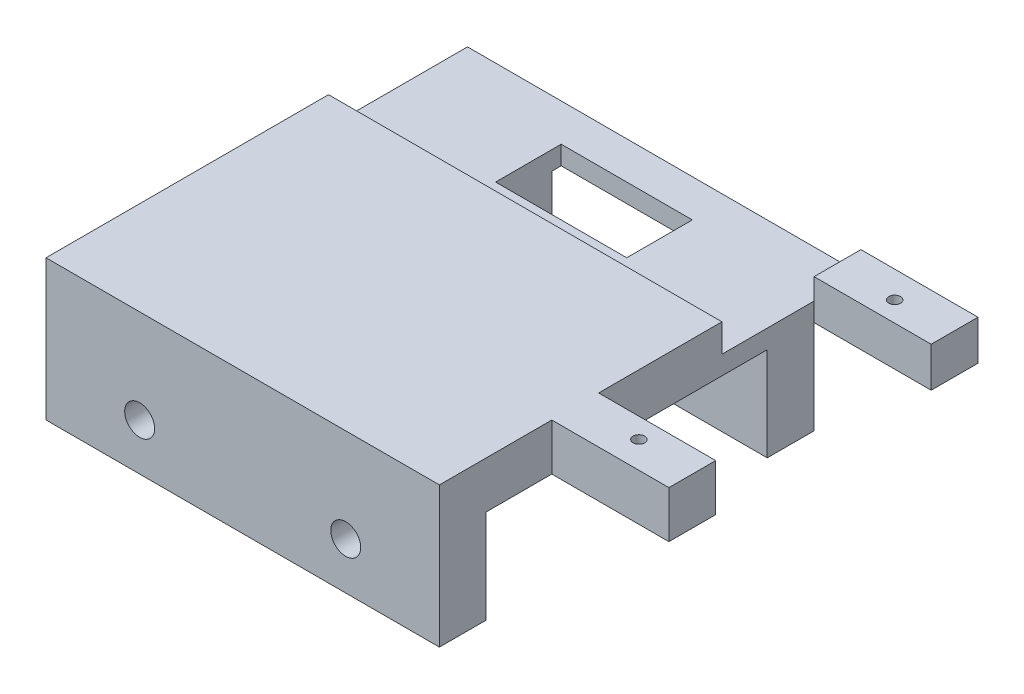
from build123d import *

# Parameters (mm, degrees)
SKETCH_1_W          = 42
SKETCH_1_H          = 45
EXTRUDE_1_DEPTH     = 5
SKETCH_2_W          = 42
SKETCH_2_H          = 5
EXTRUDE_2_DEPTH     = 10
SKETCH_3_R          = 1.6
CUT_EXTRUDE_1_DEPTH = 59.855755878
SKETCH_4_W          = 14
SKETCH_4_H          = 7
CUT_EXTRUDE_2_DEPTH = 64.356136246
SKETCH_5_W          = 42
SKETCH_5_H          = 14.838100381
CUT_EXTRUDE_3_DEPTH = 3
SKETCH_6_W          = 5
SKETCH_6_H          = 30
EXTRUDE_3_DEPTH     = 10
SKETCH_7_R          = 1.75
CUT_EXTRUDE_4_DEPTH = 60.110066825
SKETCH_8_R          = 3.5
CUT_EXTRUDE_5_DEPTH = 2
SKETCH_9_W          = 5
SKETCH_9_H          = 5
SKETCH_9_H_2        = 4.255093553
EXTRUDE_4_DEPTH     = 12.5
SKETCH_10_R         = 0.625
CUT_EXTRUDE_6_DEPTH = 72.381019886


with BuildPart() as part:
    # 草图1 → 凸台-拉伸1 (new body)
    with BuildSketch(Plane(origin=(0, 0, 0), x_dir=(1, 0, 0), z_dir=(0, 1, 0))):
        with Locations((21, -22.5)):
            Rectangle(SKETCH_1_W, SKETCH_1_H)
    extrude(amount=EXTRUDE_1_DEPTH)

    # 草图2 → 凸台-拉伸2 (add)
    with BuildSketch(Plane.XZ):
        with Locations((21, 42.5)):
            Rectangle(SKETCH_2_W, SKETCH_2_H)
        with Locations((21, 7.5)):
            Rectangle(SKETCH_2_W, SKETCH_2_H)
    extrude(amount=EXTRUDE_2_DEPTH)

    # 草图3 → 切除-拉伸1 (cut, through all)
    with BuildSketch(Plane(origin=(0, 0, 5), x_dir=(-1, 0, 0), z_dir=(0, 0, -1))):
        with Locations((-32, -5)):
            Circle(SKETCH_3_R)
        with Locations((-10, -5)):
            Circle(SKETCH_3_R)
    extrude(amount=-CUT_EXTRUDE_1_DEPTH, mode=Mode.SUBTRACT)

    # 草图4 → 切除-拉伸2 (cut, through all)
    with BuildSketch(Plane.XZ.offset(10)):
        with Locations((21, 7.5)):
            Rectangle(SKETCH_4_W, SKETCH_4_H)
    extrude(amount=-CUT_EXTRUDE_2_DEPTH, mode=Mode.SUBTRACT)

    # 草图5 → 切除-拉伸3 (cut)
    with BuildSketch(Plane(origin=(0, 5, 0), x_dir=(1, 0, 0), z_dir=(0, 1, 0))):
        with Locations((21, -7.419050191)):
            Rectangle(SKETCH_5_W, SKETCH_5_H)
    extrude(amount=-CUT_EXTRUDE_3_DEPTH, mode=Mode.SUBTRACT)

    # 草图6 → 凸台-拉伸3 (add)
    with BuildSketch(Plane.XZ):
        with Locations((2.5, 25)):
            Rectangle(SKETCH_6_W, SKETCH_6_H)
    extrude(amount=EXTRUDE_3_DEPTH)

    # 草图7 → 切除-拉伸4 (cut, through all)
    with BuildSketch(Plane(origin=(5, 0, 0), x_dir=(0, 0, -1), z_dir=(1, 0, 0))):
        with Locations((-35, -5)):
            Circle(SKETCH_7_R)
        with Locations((-15, -5)):
            Circle(SKETCH_7_R)
    extrude(amount=-CUT_EXTRUDE_4_DEPTH, mode=Mode.SUBTRACT)

    # 草图8 → 切除-拉伸5 (cut)
    with BuildSketch(Plane(origin=(5, 0, 0), x_dir=(0, 0, -1), z_dir=(1, 0, 0))):
        with Locations((-35, -5)):
            Circle(SKETCH_8_R)
    extrude(amount=-CUT_EXTRUDE_5_DEPTH, mode=Mode.SUBTRACT)

    # 草图9 → 凸台-拉伸4 (add)
    with BuildSketch(Plane(origin=(42, 0, 0), x_dir=(0, 0, -1), z_dir=(1, 0, 0))):
        with Locations((-30.5, 2.5)):
            Rectangle(SKETCH_9_W, SKETCH_9_H)
        with Locations((-2.5, 2.127546777)):
            Rectangle(SKETCH_9_W, SKETCH_9_H_2)
    extrude(amount=EXTRUDE_4_DEPTH)

    # 草图10 → 切除-拉伸6 (cut, through all)
    with BuildSketch(Plane.XZ):
        with Locations(Location((48.45, 30.15, 0), (0, 0, 270))):
            Circle(SKETCH_10_R)
        with Locations(Location((48.45, 2.85, 0), (0, 0, 270))):
            Circle(SKETCH_10_R)
    extrude(amount=-CUT_EXTRUDE_6_DEPTH, mode=Mode.SUBTRACT)


solid = part.part
